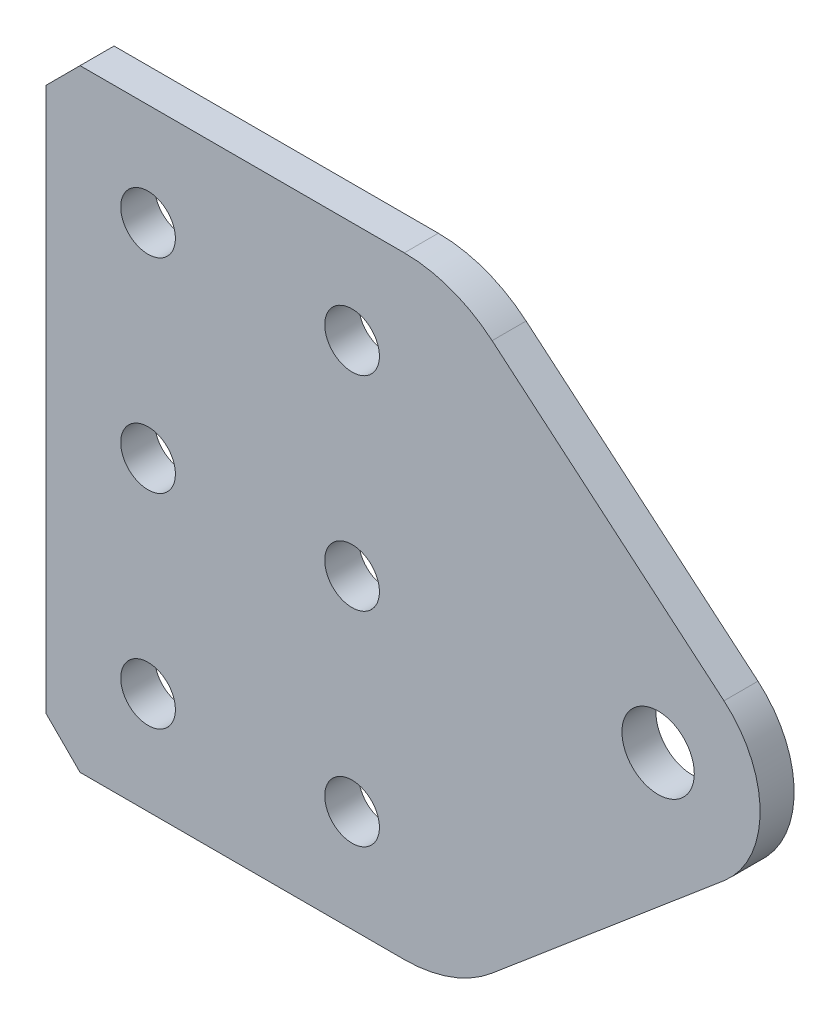
from build123d import *

# Parameters (mm, degrees)
SKETCH1_R              = 3.3782
BOSS_EXTRUDE1_DEPTH    = 3.175
F_10_CLEARANCE_HOLE1_D = 5.1054
CHAMFER1_SIZE          = 3.175


with BuildPart() as part:
    # Sketch1 → Boss-Extrude1 (new body)
    with BuildSketch(Plane.XY):
        with BuildLine():
            Line((0, 0), (33.451477372, 0))
            ThreePointArc((33.451477372, 0), (37.816769242, 0.77380082), (41.650113644, 3.000909152))
            Line((41.650113644, 3.000909152), (63.298977204, 21.300681864))
            ThreePointArc((63.298977204, 21.300681864), (66.675, 28.575), (63.298977204, 35.849318136))
            Line((63.298977204, 35.849318136), (41.650113644, 54.149090848))
            ThreePointArc((41.650113644, 54.149090848), (37.816769242, 56.37619918), (33.451477372, 57.15))
            Line((33.451477372, 57.15), (0, 57.15))
            Line((0, 57.15), (0, 0))
        make_face()
        with Locations((57.15, 28.575)):
            Circle(SKETCH1_R, mode=Mode.SUBTRACT)
    extrude(amount=BOSS_EXTRUDE1_DEPTH)

    # #10 Clearance Hole1 (through all)
    with Locations(Plane.XY.offset(3.175)):
        with Locations((28.575, 28.575), (9.525, 28.575), (9.525, 47.625), (28.575, 47.625), (28.575, 9.525), (9.525, 9.525)):
            Hole(F_10_CLEARANCE_HOLE1_D / 2)

    # Chamfer1
    chamfer1_edges = [part.edges().sort_by_distance(p)[0] for p in [
        (0, 57.15, 1.5875),
        (0, 0, 1.5875),
    ]]
    chamfer(chamfer1_edges, length=CHAMFER1_SIZE)


solid = part.part
